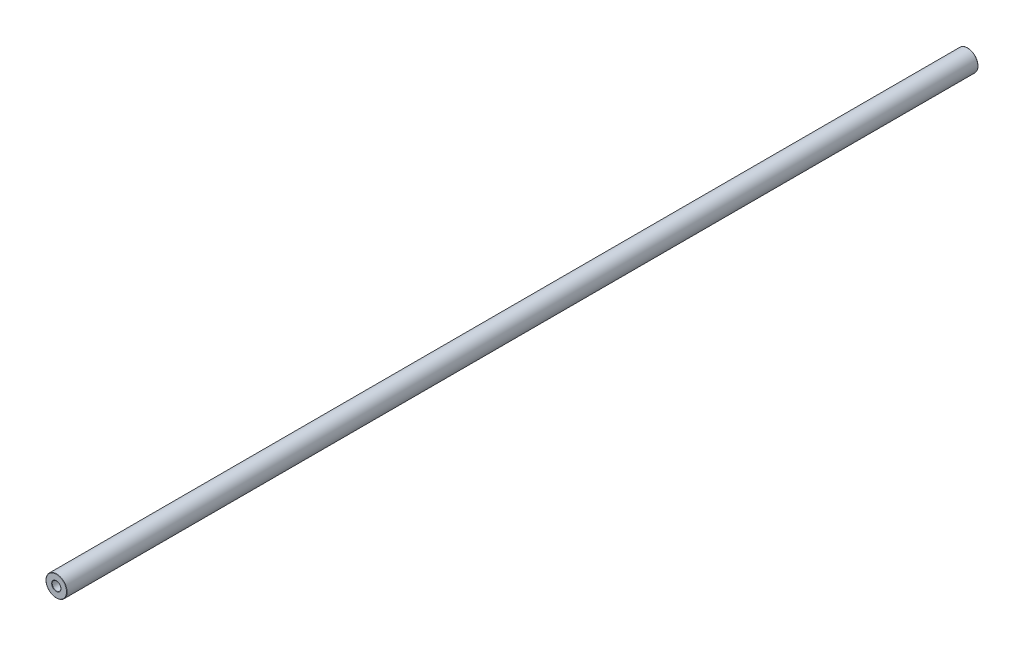
from build123d import *

# Parameters (mm, degrees)
SKETCH1_R          = 3
EXTRUDE1_DEPTH     = 260
SKETCH2_R          = 1.25
CUT_EXTRUDE1_DEPTH = 20
CUT_EXTRUDE2_START = -20
SKETCH3_R          = 1.25
CUT_EXTRUDE2_DEPTH = 20
FILLET1_R          = 0.1


with BuildPart() as part:
    # Sketch1 → Extrude1 (new body)
    with BuildSketch(Plane.XY):
        Circle(SKETCH1_R)
    extrude(amount=EXTRUDE1_DEPTH)

    # Sketch2 → Cut-Extrude1 (cut)
    with BuildSketch(Plane.XY.offset(260)):
        Circle(SKETCH2_R)
    extrude(amount=-CUT_EXTRUDE1_DEPTH, mode=Mode.SUBTRACT)

    # Sketch3 → Cut-Extrude2 (cut)
    with BuildSketch(Plane(origin=(0, 0, 0), x_dir=(-1, 0, 0), z_dir=(0, 0, -1)).offset(CUT_EXTRUDE2_START)):
        with Locations(Location((0, 0, 0), (0, 0, 180))):
            Circle(SKETCH3_R)
    extrude(amount=CUT_EXTRUDE2_DEPTH, mode=Mode.SUBTRACT)

    # Fillet1
    fillet1_edges = [part.edges().sort_by_distance(p)[0] for p in [
        (-1.25, 0, 0),
        (-3, 0, 0),
        (-3, 0, 260),
        (-1.25, 0, 260),
    ]]
    fillet(fillet1_edges, radius=FILLET1_R)


solid = part.part
